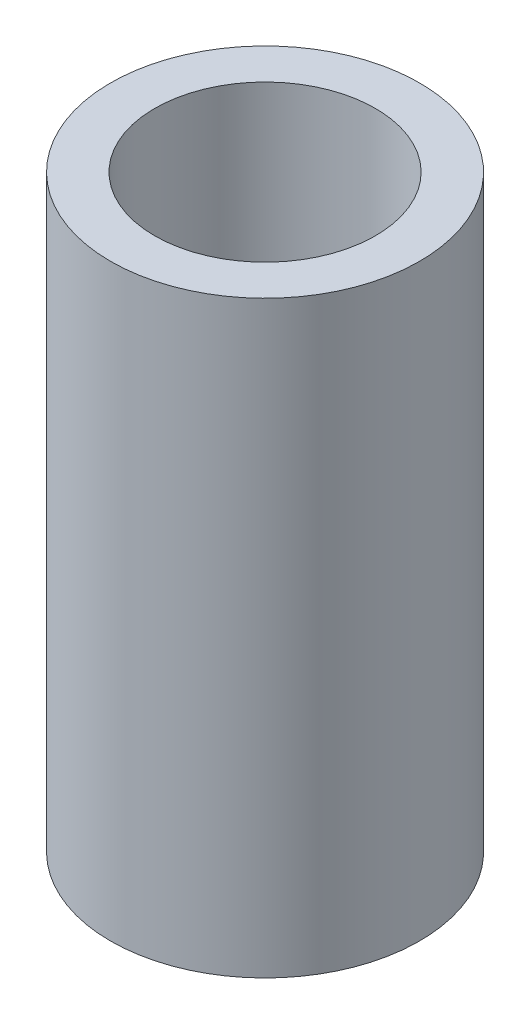
from build123d import *

# Parameters (mm, degrees)
SKETCH_1_R      = 2.1
SKETCH_1_R_2    = 1.5
EXTRUDE_1_DEPTH = 4


with BuildPart() as part:
    # 草图1 → 凸台-拉伸1 (new, symmetric)
    with BuildSketch(Plane(origin=(0, 0, 0), x_dir=(1, 0, 0), z_dir=(0, 1, 0))):
        with Locations(Location((0, 0, 0), (0, 0, 270))):
            Circle(SKETCH_1_R)
        with Locations(Location((0, 0, 0), (0, 0, 270))):
            Circle(SKETCH_1_R_2, mode=Mode.SUBTRACT)
    extrude(amount=EXTRUDE_1_DEPTH, both=True)


solid = part.part
